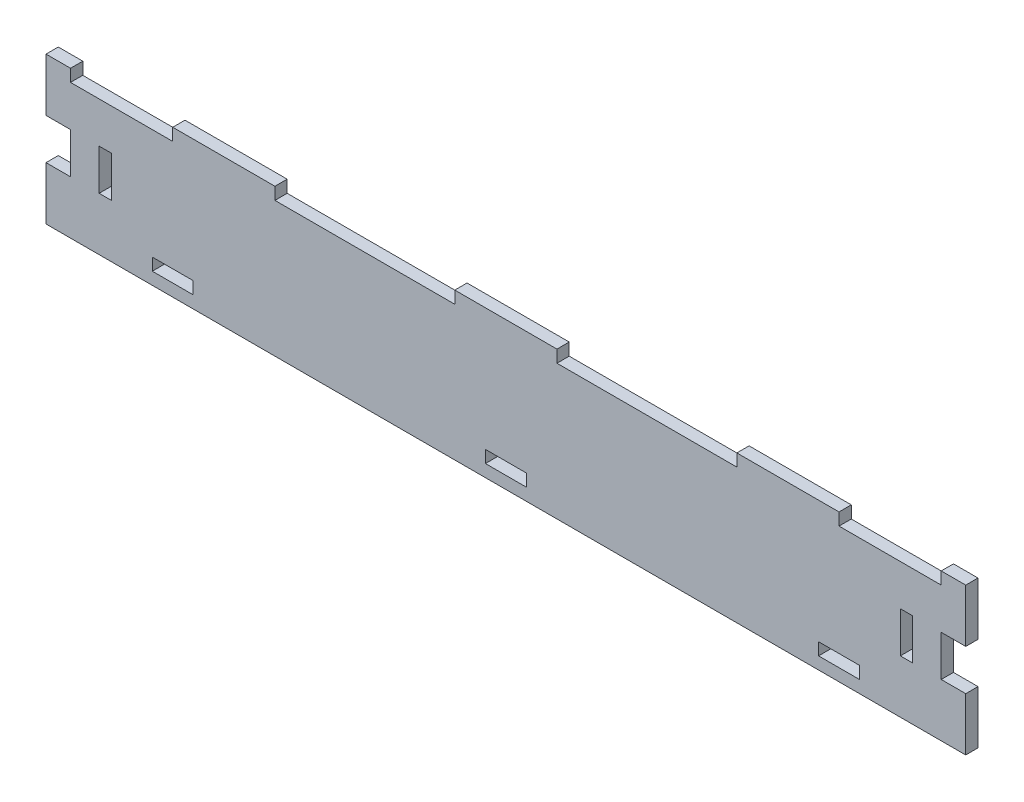
from build123d import *

# Parameters (mm, degrees)
SKETCH_1_W      = 20
SKETCH_1_H      = 6
SKETCH_1_W_2    = 6
SKETCH_1_H_2    = 20
EXTRUDE_1_DEPTH = 6


with BuildPart() as part:
    # Эскиз1 → Бобышка-Вытянуть1 (new body)
    with BuildSketch(Plane.XY):
        Polygon((0, 60), (0, 66), (12, 66), (12, 60), (62, 60), (62, 66), (112, 66), (112, 60), (200, 60), (200, 66), (250, 66), (250, 60), (338, 60), (338, 66), (388, 66), (388, 60), (438, 60), (438, 66), (450, 66), (450, 60), (450, 40), (438, 40), (438, 20), (450, 20), (450, 0), (450, -6), (0, -6), (0, 0), (0, 20), (12, 20), (12, 40), (0, 40), align=None)
        with Locations((62, 3)):
            Rectangle(SKETCH_1_W, SKETCH_1_H, mode=Mode.SUBTRACT)
        with Locations((225, 3)):
            Rectangle(SKETCH_1_W, SKETCH_1_H, mode=Mode.SUBTRACT)
        with Locations((388, 3)):
            Rectangle(SKETCH_1_W, SKETCH_1_H, mode=Mode.SUBTRACT)
        with Locations((29, 30)):
            Rectangle(SKETCH_1_W_2, SKETCH_1_H_2, mode=Mode.SUBTRACT)
        with Locations((421, 30)):
            Rectangle(SKETCH_1_W_2, SKETCH_1_H_2, mode=Mode.SUBTRACT)
    extrude(amount=EXTRUDE_1_DEPTH)


solid = part.part
